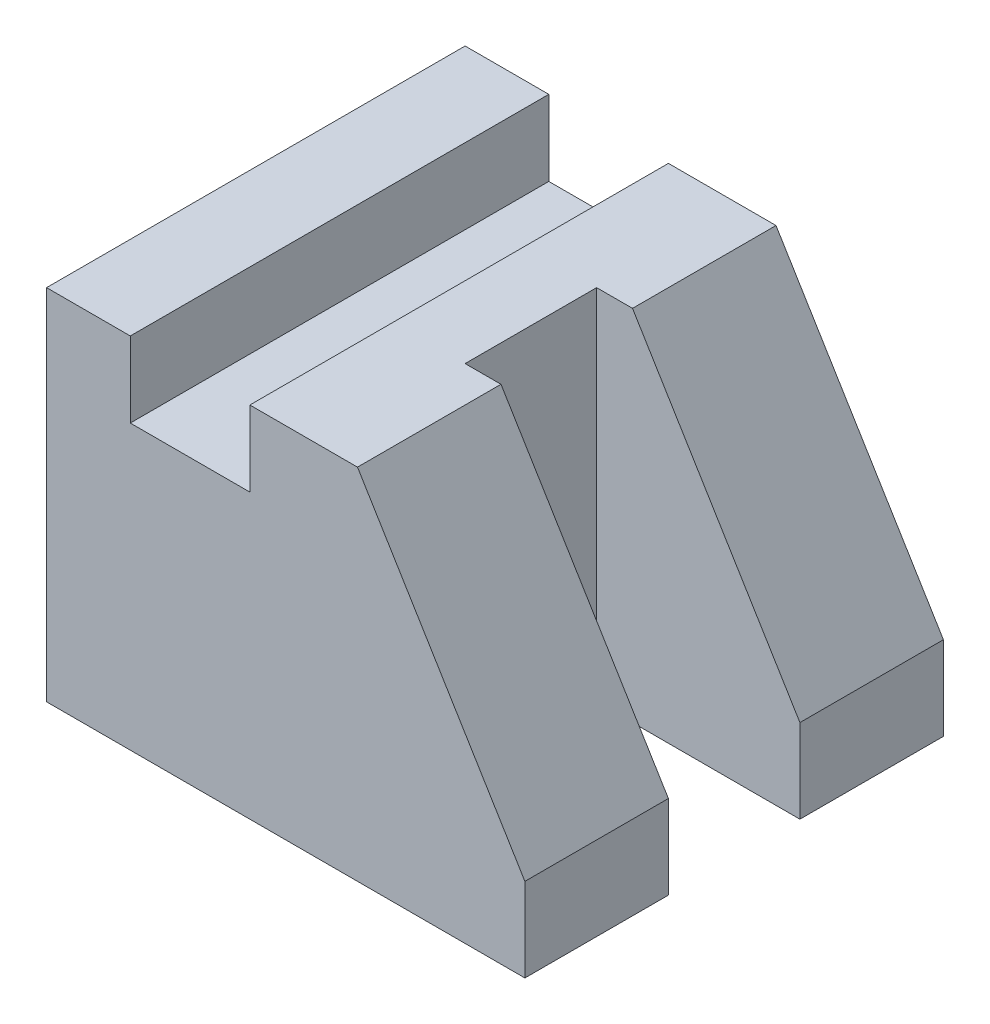
from build123d import *

# Parameters (mm, degrees)
Y_KSEKLIK_EKSTR_ZYON1_DEPTH = 1778
IZIM2_W                     = 1047.214946636
IZIM2_H                     = 558.8
KES_EKSTR_ZYON2_DEPTH       = 1778


with BuildPart() as part:
    # Çizim1 → Yükseklik-Ekstrüzyon1 (new body)
    with BuildSketch(Plane.XY):
        Polygon((-2473.569230769, 963.246153846), (-2473.569230769, -560.753846154), (-441.569230769, -560.753846154), (-441.569230769, -205.153846154), (-1152.769230769, 963.246153846), (-1609.969230769, 963.246153846), (-1609.969230769, 642.815384615), (-2117.969230769, 642.815384615), (-2117.969230769, 963.246153846), align=None)
    extrude(amount=Y_KSEKLIK_EKSTR_ZYON1_DEPTH)

    # Çizim2 → Kes-Ekstrüzyon2 (cut)
    with BuildSketch(Plane(origin=(0, 963.246153846, 0), x_dir=(1, 0, 0), z_dir=(0, 1, 0))):
        with Locations((-781.561757451, -889)):
            Rectangle(IZIM2_W, IZIM2_H)
    extrude(amount=-KES_EKSTR_ZYON2_DEPTH, mode=Mode.SUBTRACT)


solid = part.part
